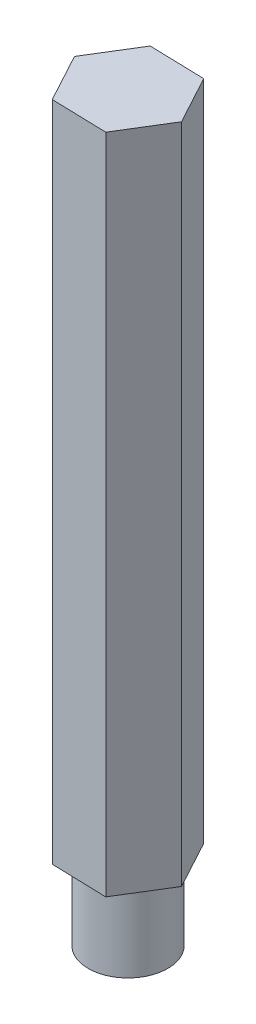
from build123d import *

# Parameters (mm, degrees)
SKETCH1_R           = 1.5
BOSS_EXTRUDE1_DEPTH = 3
BOSS_EXTRUDE2_DEPTH = 25


with BuildPart() as part:
    # Sketch1 → Boss-Extrude1 (new body)
    with BuildSketch(Plane(origin=(0, 0, 0), x_dir=(1, 0, 0), z_dir=(0, 1, 0))):
        with Locations(Location((0, 0, 0), (0, 0, 270))):
            Circle(SKETCH1_R)
    extrude(amount=BOSS_EXTRUDE1_DEPTH)

    # Sketch2 → Boss-Extrude2 (add)
    with BuildSketch(Plane(origin=(0, 3, 0), x_dir=(1, 0, 0), z_dir=(0, 1, 0))):
        Polygon((-0.98915483, 1.827996915), (-2.077669182, 0.057365247), (-1.088514352, -1.770631668), (0.98915483, -1.827996915), (2.077669182, -0.057365247), (1.088514352, 1.770631668), align=None)
    extrude(amount=BOSS_EXTRUDE2_DEPTH)


solid = part.part
